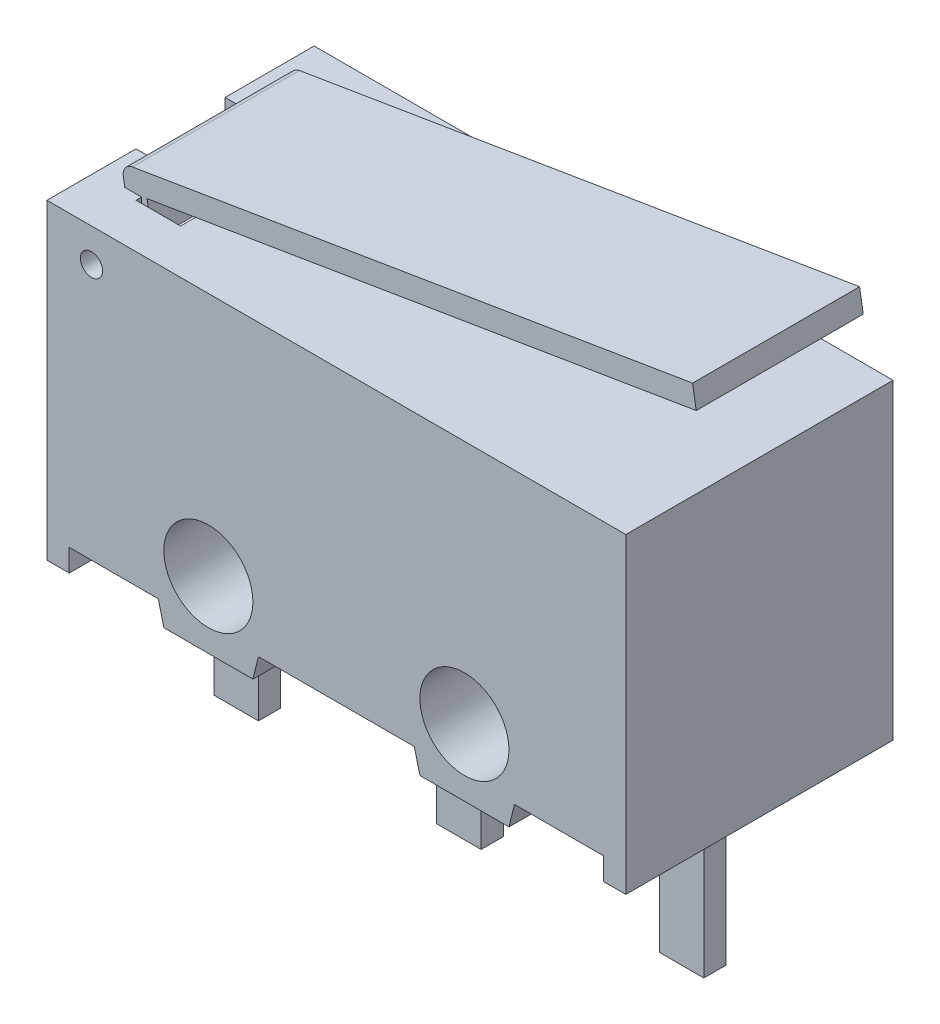
from build123d import *

# Parameters (mm, degrees)
BOSS_EXTRUDE1_DEPTH     = 3
CUT_EXTRUDE1_DEPTH      = 8.968688725
CUT_EXTRUDE1_DEPTH_BACK = 8.968688725
SKETCH2_R               = 1
SKETCH3_W               = 1
SKETCH3_H               = 0.5
BOSS_EXTRUDE2_DEPTH     = 4
BOSS_EXTRUDE2_2_DEPTH   = 4
BOSS_EXTRUDE2_3_DEPTH   = 4
CUT_EXTRUDE2_DEPTH      = 11.012492197
CUT_EXTRUDE2_DEPTH_BACK = 11.012492197
SKETCH5_R               = 0.25
SKETCH6_W               = 1
SKETCH6_H               = 4
SKETCH6_H_2             = 2
CUT_EXTRUDE3_DEPTH      = 2
BOSS_EXTRUDE3_DEPTH     = 1.875


with BuildPart() as part:
    # Sketch1 → Boss-Extrude1 (new, symmetric)
    with BuildSketch(Plane.XY):
        Polygon((-6.5, -3.5), (-6, -3.5), (-6, -3), (-4, -3), (-3.875, -3.5), (-1.875, -3.5), (-1.75, -3), (1.75, -3), (1.875, -3.5), (3.875, -3.5), (4, -3), (6, -3), (6, -3.5), (6.5, -3.5), (6.5, 3.5), (-6.5, 3.5), align=None)
    extrude(amount=BOSS_EXTRUDE1_DEPTH, both=True)

    # Sketch2 → Cut-Extrude1 (cut, two sides: drawn at the far end of the back side and taken through both)
    with BuildSketch(Plane.XY.offset(-CUT_EXTRUDE1_DEPTH_BACK)):
        with Locations((-2.875, -2)):
            Circle(SKETCH2_R)
        with Locations((2.875, -2)):
            Circle(SKETCH2_R)
    extrude(amount=CUT_EXTRUDE1_DEPTH + CUT_EXTRUDE1_DEPTH_BACK, mode=Mode.SUBTRACT)

    # Sketch5 → Cut-Extrude2 (cut, two sides: drawn at the far end of the back side and taken through both)
    with BuildSketch(Plane.XY.offset(-CUT_EXTRUDE2_DEPTH_BACK)):
        with Locations((-5.5, 2.75)):
            Circle(SKETCH5_R)
    extrude(amount=CUT_EXTRUDE2_DEPTH + CUT_EXTRUDE2_DEPTH_BACK, mode=Mode.SUBTRACT)

    # Sketch6 → Cut-Extrude3 (cut)
    with BuildSketch(Plane(origin=(0, 3.5, 0), x_dir=(1, 0, 0), z_dir=(0, 1, 0))):
        with Locations((-5, 0)):
            Rectangle(SKETCH6_W, SKETCH6_H)
        with Locations((-6, 0)):
            Rectangle(SKETCH6_W, SKETCH6_H_2)
    extrude(amount=-CUT_EXTRUDE3_DEPTH, mode=Mode.SUBTRACT)


with BuildPart() as body_2:
    # Sketch3 → Boss-Extrude2 (new body)
    with BuildSketch(Plane.XZ.offset(3)):
        Rectangle(SKETCH3_W, SKETCH3_H)
    extrude(amount=BOSS_EXTRUDE2_DEPTH)


with BuildPart() as body_3:
    # Sketch3 → Boss-Extrude2 2 (new body)
    with BuildSketch(Plane.XZ.offset(3)):
        with Locations((-5, 0)):
            Rectangle(SKETCH3_W, SKETCH3_H)
    extrude(amount=BOSS_EXTRUDE2_2_DEPTH)


with BuildPart() as body_4:
    # Sketch3 → Boss-Extrude2 3 (new body)
    with BuildSketch(Plane.XZ.offset(3)):
        with Locations((5, 0)):
            Rectangle(SKETCH3_W, SKETCH3_H)
    extrude(amount=BOSS_EXTRUDE2_3_DEPTH)


with BuildPart() as body_5:
    # Sketch4 → Boss-Extrude3 (new, symmetric)
    with BuildSketch(Plane.XY):
        with BuildLine():
            Line((6.873784044, 6.068805273), (-5.704474769, 3.983162629))
            ThreePointArc((-5.704474769, 3.983162629), (-5.866892446, 3.882008535), (-5.910212341, 3.695635149))
            Line((-5.910212341, 3.695635149), (-5.746632526, 2.709105046))
            Line((-5.746632526, 2.709105046), (-5.253367474, 2.790894954))
            Line((-5.253367474, 2.790894954), (-5.376052336, 3.530792531))
            Line((-5.376052336, 3.530792531), (6.955573951, 5.575540222))
            Line((6.955573951, 5.575540222), (6.873784044, 6.068805273))
        make_face()
    extrude(amount=BOSS_EXTRUDE3_DEPTH, both=True)


solid = Compound([part.part, body_2.part, body_3.part, body_4.part, body_5.part])
